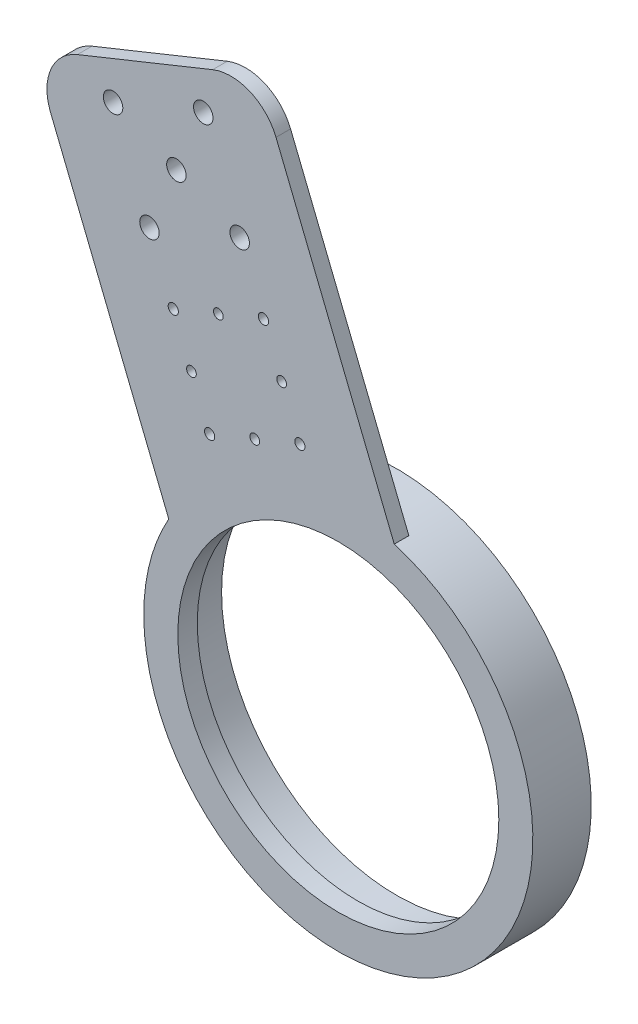
from build123d import *

# Parameters (mm, degrees)
SKETCH_1_R          = 40
SKETCH_1_R_2        = 33
EXTRUDE_1_DEPTH     = 4
EXTRUDE_START       = 8
SKETCH_2_R          = 40
SKETCH_2_R_2        = 36
EXTRUDE_2_DEPTH     = 8
EXTRUDE_3_DEPTH     = 3
SKETCH_5_R          = 1.05
SKETCH_5_R_2        = 1
SKETCH_5_R_3        = 2
CUT_EXTRUDE_1_DEPTH = 5
FILLET_1_R          = 10


with BuildPart() as part:
    # 草图1 → 凸台-拉伸1 (new body)
    with BuildSketch(Plane.XY):
        with Locations((-86.606649797, -63.783530386)):
            Circle(SKETCH_1_R)
        with Locations((-86.606649797, -63.783530386)):
            Circle(SKETCH_1_R_2, mode=Mode.SUBTRACT)
    extrude(amount=EXTRUDE_1_DEPTH)

    # 草图2 → 凸台-拉伸2 (add)
    with BuildSketch(Plane(origin=(0, 0, 0), x_dir=(-1, 0, 0), z_dir=(0, 0, -1)).offset(EXTRUDE_START)):
        with Locations((86.606649797, -63.783530386)):
            Circle(SKETCH_2_R)
        with Locations((86.606649797, -63.783530386)):
            Circle(SKETCH_2_R_2, mode=Mode.SUBTRACT)
    extrude(amount=-EXTRUDE_2_DEPTH)

    # 草图4 → 凸台-拉伸3 (add)
    with BuildSketch(Plane.XY.offset(4)):
        with BuildLine():
            Line((-103.161659788, 44.080644126), (-149.530913489, 25.375235519))
            Line((-149.530913489, 25.375235519), (-119.454633349, -49.181524695))
            ThreePointArc((-119.454633349, -49.181524695), (-100.016535475, -30.541466329), (-73.085379648, -30.476116088))
            Line((-73.085379648, -30.476116088), (-103.161659788, 44.080644126))
        make_face()
    extrude(amount=-EXTRUDE_3_DEPTH)

    # 草图5 → 切除-拉伸1 (cut)
    with BuildSketch(Plane(origin=(0, 0, 1), x_dir=(-1, 0, 0), z_dir=(0, 0, -1))):
        with Locations((113.059715781, -24.852893212)):
            Circle(SKETCH_5_R)
        with Locations((120.541879224, -6.305191731)):
            Circle(SKETCH_5_R)
        with Locations((101.994177743, 1.176971711)):
            Circle(SKETCH_5_R)
        with Locations((94.512014301, -17.370729769)):
            Circle(SKETCH_5_R)
        with Locations((116.800797503, -15.579042472)):
            Circle(SKETCH_5_R_2)
        with Locations((98.253096022, -8.096879029)):
            Circle(SKETCH_5_R_2)
        with Locations((103.785865041, -21.111811491)):
            Circle(SKETCH_5_R_2)
        with Locations((111.268028484, -2.56411001)):
            Circle(SKETCH_5_R_2)
        with Locations((114.369508098, 31.768673665)):
            Circle(SKETCH_5_R_3)
        with Locations((132.917209579, 24.286510222)):
            Circle(SKETCH_5_R_3)
        with Locations((119.902277117, 18.753741203)):
            Circle(SKETCH_5_R_3)
        with Locations((125.435046136, 5.738808742)):
            Circle(SKETCH_5_R_3)
        with Locations((106.887344656, 13.220972184)):
            Circle(SKETCH_5_R_3)
    extrude(amount=-CUT_EXTRUDE_1_DEPTH, mode=Mode.SUBTRACT)

    # 圆角1
    fillet_1_edges = [part.edges().sort_by_distance(p)[0] for p in [
        (-149.530913489, 25.375235519, 2.5),
        (-103.161659788, 44.080644126, 2.5),
    ]]
    fillet(fillet_1_edges, radius=FILLET_1_R)


solid = part.part
